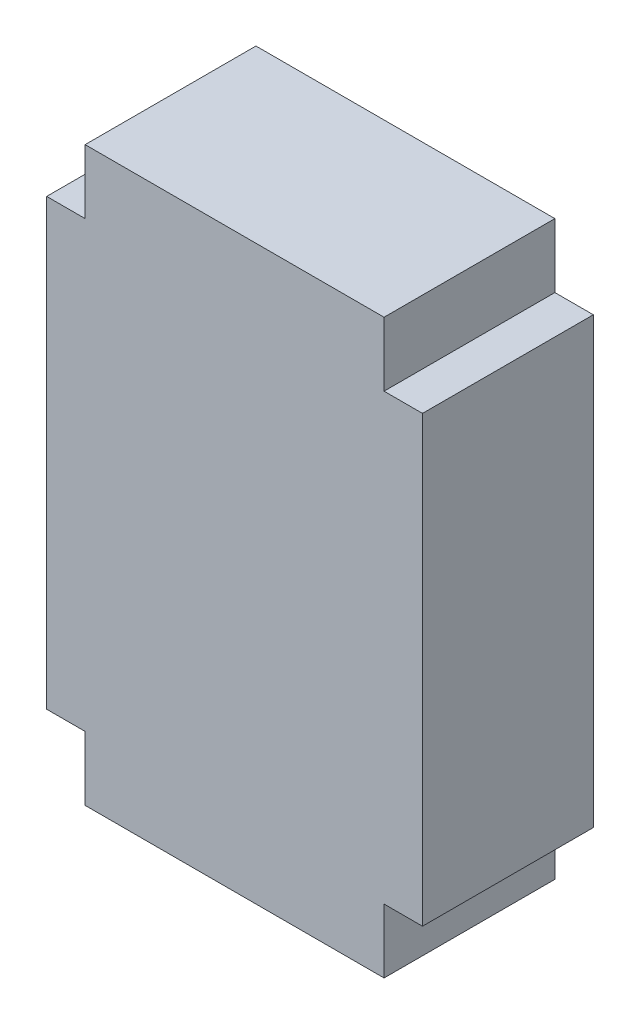
from build123d import *

# Parameters (mm, degrees)
COMPONENT_OUTLINE_DEPTH = 1


with BuildPart() as part:
    # 草图1 → Component_Outline (new body)
    with BuildSketch(Plane.XY):
        Polygon((-1.1, 1.3), (-0.875, 1.3), (-0.875, 1.675), (0.875, 1.675), (0.875, 1.3), (1.1, 1.3), (1.1, -1.3), (0.875, -1.3), (0.875, -1.675), (-0.875, -1.675), (-0.875, -1.3), (-1.1, -1.3), align=None)
    extrude(amount=COMPONENT_OUTLINE_DEPTH)


solid = part.part
